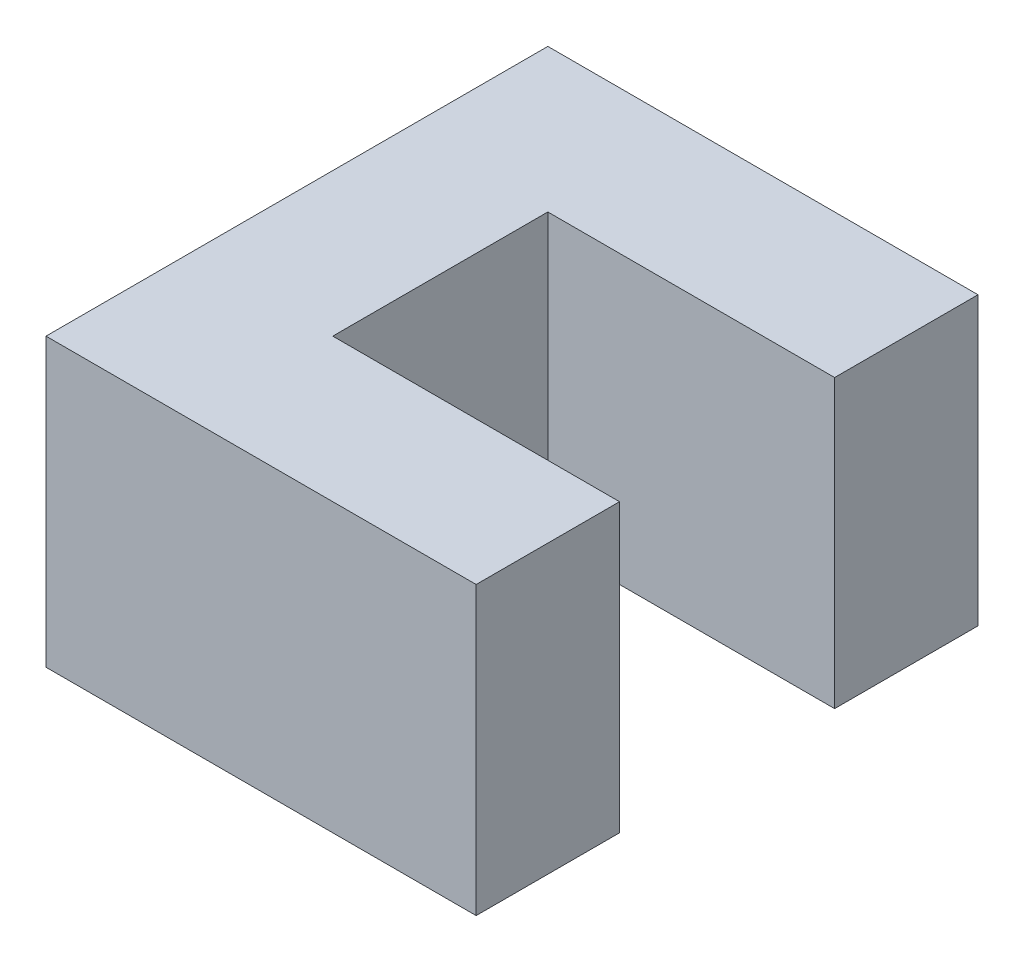
from build123d import *

# Parameters (mm, degrees)
BOSS_EXTRUDE1_DEPTH = 20


with BuildPart() as part:
    # Sketch1 → Boss-Extrude1 (new body)
    with BuildSketch(Plane(origin=(0, 0, 0), x_dir=(1, 0, 0), z_dir=(0, 1, 0))):
        Polygon((0, 0), (0, -35), (30, -35), (30, -25), (10, -25), (10, -10), (30, -10), (30, 0), align=None)
    extrude(amount=BOSS_EXTRUDE1_DEPTH)


solid = part.part
